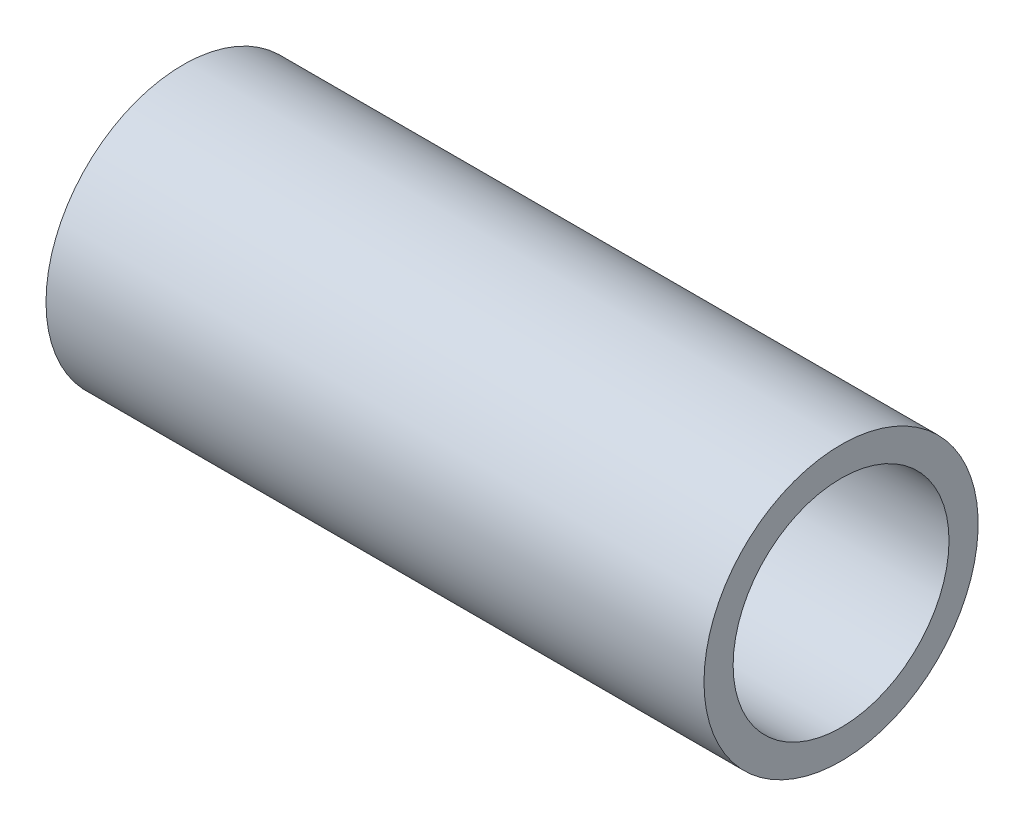
from build123d import *

# Parameters (mm, degrees)
SKETCH1_R          = 15.875
SKETCH1_R_2        = 12.5
BASE_EXTRUDE_DEPTH = 76.2


with BuildPart() as part:
    # Sketch1 → Base-Extrude (new body)
    with BuildSketch(Plane(origin=(0, 0, 0), x_dir=(0, 0, -1), z_dir=(1, 0, 0))):
        with Locations(Location((0, 0, 0), (0, 0, 180))):
            Circle(SKETCH1_R)
        with Locations(Location((0, 0, 0), (0, 0, 180))):
            Circle(SKETCH1_R_2, mode=Mode.SUBTRACT)
    extrude(amount=BASE_EXTRUDE_DEPTH)


solid = part.part
